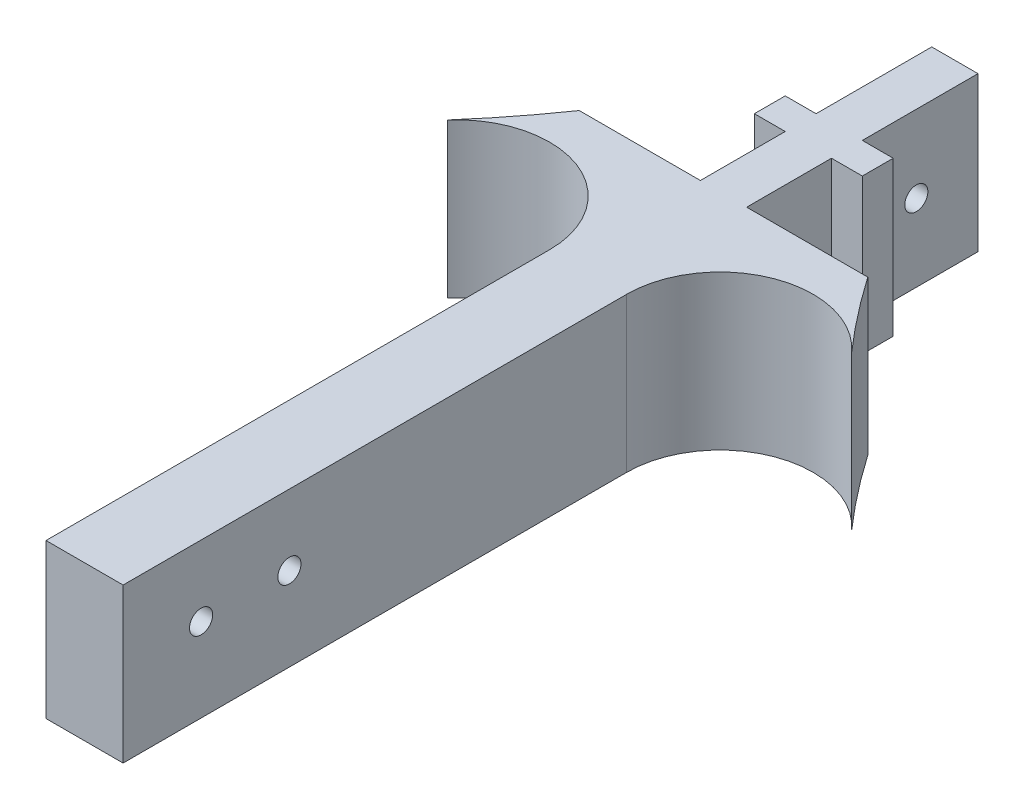
from build123d import *

# Parameters (mm, degrees)
BOSS_EXTRU_1_DEPTH      = 20
ESQUISSE3_R             = 1.5
ENL_V_MAT_EXTRU_3_DEPTH = 20
ESQUISSE4_R             = 1.5
ENL_V_MAT_EXTRU_4_DEPTH = 10
ESQUISSE5_R             = 1.5
ENL_V_MAT_EXTRU_5_DEPTH = 10


with BuildPart() as part:
    # Esquisse1 → Boss.-Extru.1 (new body)
    with BuildSketch(Plane(origin=(0, 0, 0), x_dir=(1, 0, 0), z_dir=(0, 1, 0))):
        with BuildLine():
            Line((-3, 84.398281038), (-3, 69.398281038))
            Line((-3, 69.398281038), (-7, 69.398281038))
            Line((-7, 69.398281038), (-7, 65.398281038))
            Line((-7, 65.398281038), (-3, 65.398281038))
            Line((-3, 65.398281038), (-3, 54.398281038))
            Line((-3, 54.398281038), (-18.71, 54.398281038))
            ThreePointArc((-18.71, 54.398281038), (-22.308577777, 49.499317693), (-26.183329952, 44.81574006))
            ThreePointArc((-26.183329952, 44.81574006), (-12.83252844, 48.159570073), (-5, 36.842476876))
            Line((-5, 36.842476876), (-5, -28.467834127))
            Line((-5, -28.467834127), (0, -28.467834127))
            Line((0, -28.467834127), (0, 84.398281038))
            Line((0, 84.398281038), (-3, 84.398281038))
        make_face()
    boss_extru_1 = extrude(amount=BOSS_EXTRU_1_DEPTH)

    # Symétrie1: Boss.-Extru.1 across plane
    add(boss_extru_1.mirror(Plane(origin=(0, 20, -84.398281038), x_dir=(0, 0, 1), z_dir=(-1, 0, 0))))

    # Esquisse3 → Enlèv. mat.-Extru.3 (cut)
    with BuildSketch(Plane.ZY.offset(3)):
        with Locations((-76.398281038, 10)):
            Circle(ESQUISSE3_R)
        with Locations((-60.398281038, 10)):
            Circle(ESQUISSE3_R)
    extrude(amount=-ENL_V_MAT_EXTRU_3_DEPTH, mode=Mode.SUBTRACT)

    # Esquisse4 → Enlèv. mat.-Extru.4 (cut)
    with BuildSketch(Plane(origin=(5, 0, 0), x_dir=(0, 0, -1), z_dir=(1, 0, 0))):
        with Locations((-18.354301853, 10.844529297)):
            Circle(ESQUISSE4_R)
    extrude(amount=-ENL_V_MAT_EXTRU_4_DEPTH, mode=Mode.SUBTRACT)

    # Esquisse5 → Enlèv. mat.-Extru.5 (cut)
    with BuildSketch(Plane(origin=(5, 0, 0), x_dir=(0, 0, -1), z_dir=(1, 0, 0))):
        with Locations((-6.902461617, 10.844529297)):
            Circle(ESQUISSE5_R)
    extrude(amount=-ENL_V_MAT_EXTRU_5_DEPTH, mode=Mode.SUBTRACT)


solid = part.part
